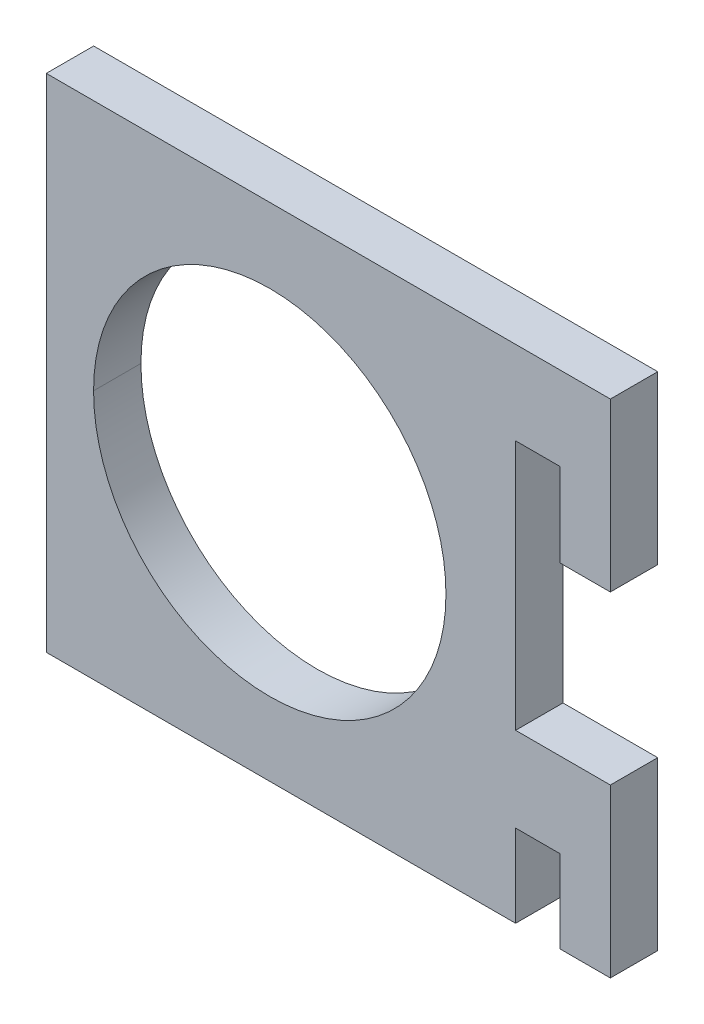
from build123d import *

# Parameters (mm, degrees)
SKETCH1_W           = 57.15
SKETCH1_H           = 50.8
BOSS_EXTRUDE1_DEPTH = 4.800000052
SKETCH3_W           = 9.600000104
SKETCH3_H           = 16.933333334
CUT_EXTRUDE2_DEPTH  = 48.255810933
SKETCH7_R           = 17.849200014
CUT_EXTRUDE6_DEPTH  = 100.442088012
SKETCH4_W           = 4.500000144
SKETCH4_H           = 8.466666666
SKETCH4_H_2         = 8.357391871
CUT_EXTRUDE7_DEPTH  = 48.255810933
SKETCH8_R           = 17.849200014
CUT_EXTRUDE8_DEPTH  = 100.528553706


with BuildPart() as part:
    # Sketch1 → Boss-Extrude1 (new body)
    with BuildSketch(Plane.XY):
        with Locations((-10.098235381, 1.329244875)):
            Rectangle(SKETCH1_W, SKETCH1_H)
    extrude(amount=BOSS_EXTRUDE1_DEPTH)

    # Sketch3 → Cut-Extrude2 (cut, through all)
    with BuildSketch(Plane.XY.offset(4.800000052)):
        with Locations((13.676764567, 1.329244875)):
            Rectangle(SKETCH3_W, SKETCH3_H)
    extrude(amount=-CUT_EXTRUDE2_DEPTH, mode=Mode.SUBTRACT)

    # Sketch7 → Cut-Extrude6 (cut, through all)
    with BuildSketch(Plane(origin=(21.96927249, 54.594199632, 4.800000052), x_dir=(0.8370756248818486, 0.5470871943563135, 0), z_dir=(0, 0, 1))):
        with Locations(Location((-61.009273933, -23.888925268, 0), (0, 0, 326.832589089))):
            Circle(SKETCH7_R)
    extrude(amount=-CUT_EXTRUDE6_DEPTH, mode=Mode.SUBTRACT)

    # Sketch4 → Cut-Extrude7 (cut, through all)
    with BuildSketch(Plane(origin=(0, 0, 0), x_dir=(-1, 0, 0), z_dir=(0, 0, -1))):
        with Locations((-11.126764587, 14.029244875)):
            Rectangle(SKETCH4_W, SKETCH4_H)
        with Locations((-11.126764587, -19.89205919)):
            Rectangle(SKETCH4_W, SKETCH4_H_2)
    extrude(amount=-CUT_EXTRUDE7_DEPTH, mode=Mode.SUBTRACT)

    # Sketch8 → Cut-Extrude8 (cut, through all)
    with BuildSketch(Plane(origin=(21.96927249, 54.703474427, 0), x_dir=(0, -1, 0), z_dir=(0, 0, -1))):
        with Locations((53.374229552, 38.000051)):
            Circle(SKETCH8_R)
    extrude(amount=-CUT_EXTRUDE8_DEPTH, mode=Mode.SUBTRACT)


solid = part.part
